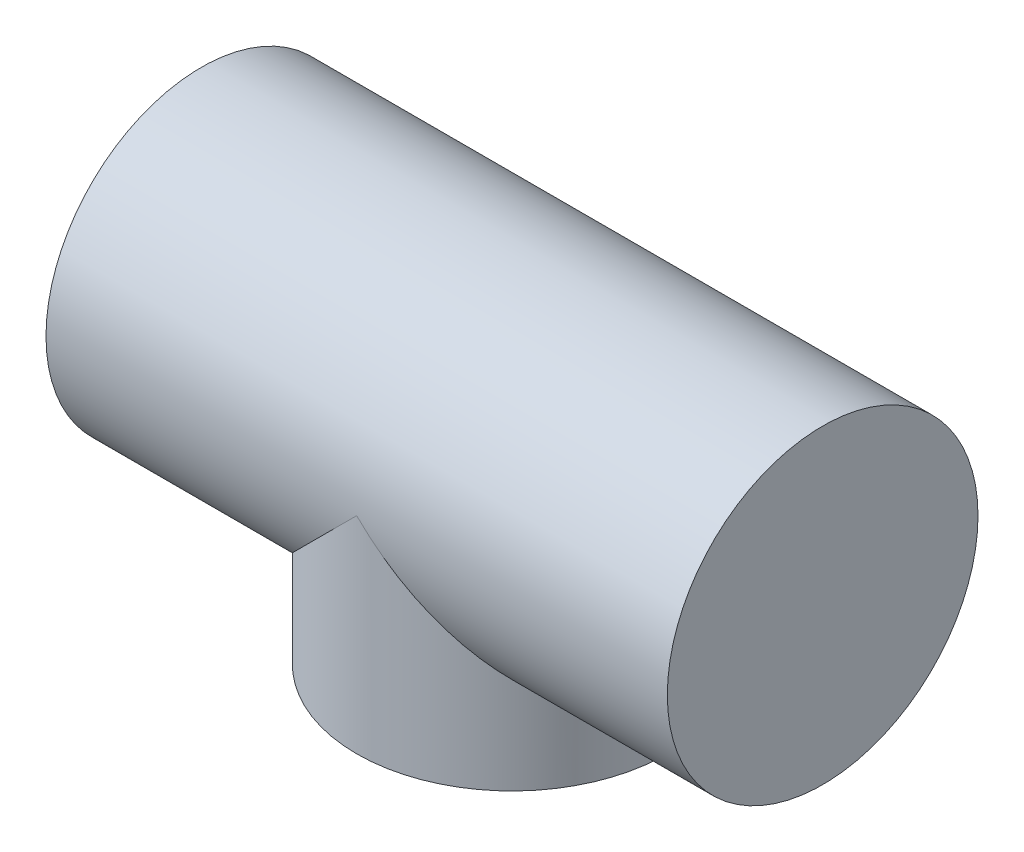
from build123d import *

# Parameters (mm, degrees)
SKETCH2_R           = 25
SKETCH4_R           = 25
BOSS_EXTRUDE1_DEPTH = 33.2


with BuildPart() as part:
    # Sweep1: sweep along a path in Sketch1
    with BuildLine(Plane.XY) as sweep1_path:
        Line((0, 0), (100, 0))
    # Sketch2 → Sweep1 (sweep)
    with BuildSketch(Plane(origin=(0, 0, 0), x_dir=(0, 0, -1), z_dir=(1, 0, 0))):
        Circle(SKETCH2_R)
    sweep(path=sweep1_path.line)

    # Sketch4 → Boss-Extrude1 (add)
    with BuildSketch(Plane(origin=(0, 0, 0), x_dir=(1, 0, 0), z_dir=(0, 1, 0))):
        with Locations(Location((50, 0, 0), (0, 0, 270))):
            Circle(SKETCH4_R)
    extrude(amount=-BOSS_EXTRUDE1_DEPTH)


solid = part.part
